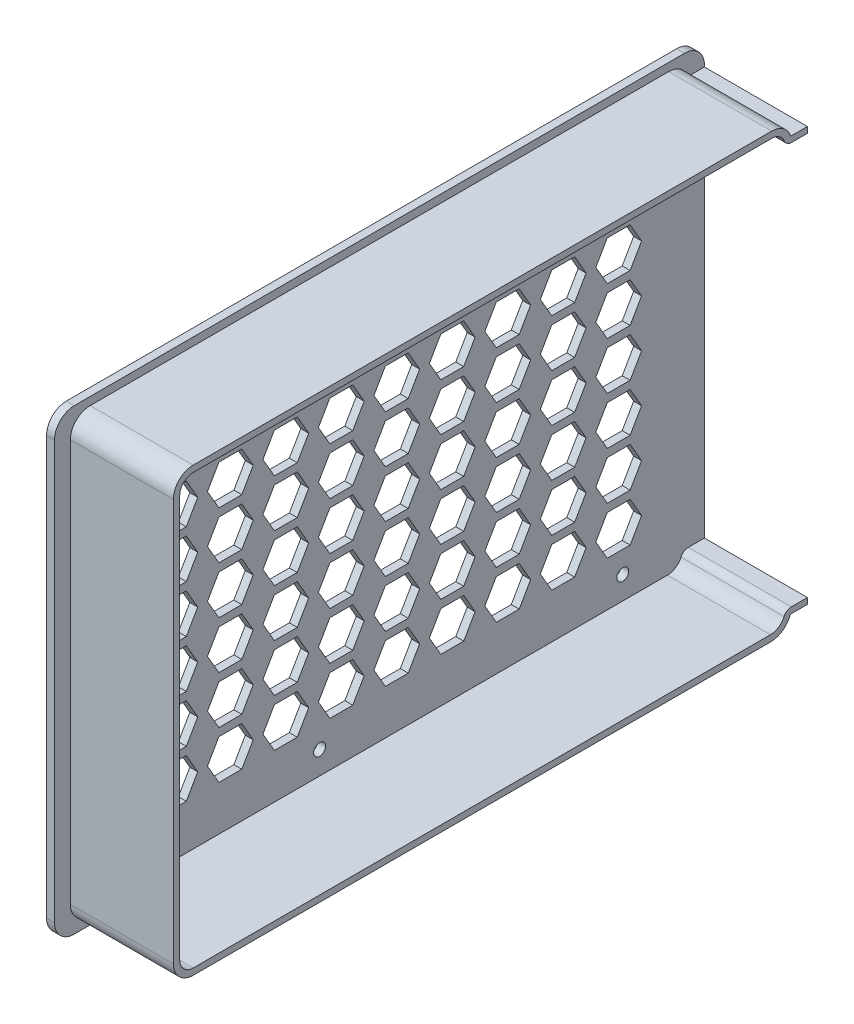
from build123d import *

# Parameters (mm, degrees)
BOSS_EXTRUDE1_DEPTH  = 2
EXTRUDE_THIN1_DEPTH  = 26
BOSS_EXTRUDE2_DEPTH  = 2
CUT_EXTRUDE3_DEPTH   = 117.841789803
LPATTERN1_COUNT      = 10
LPATTERN1_PITCH      = 14
LPATTERN1_COUNT_DIR2 = 7
LPATTERN1_PITCH_DIR2 = 12
SKETCH6_R            = 1.5
CUT_EXTRUDE4_DEPTH   = 117.841789803
SKETCH7_W            = 1.6
SKETCH7_H            = 101.5
CUT_EXTRUDE5_DEPTH   = 26
SKETCH8_W            = 5.6
SKETCH8_H            = 1.5
BOSS_EXTRUDE3_DEPTH  = 26
FILLET1_R            = 2


with BuildPart() as part:
    # Sketch1 → Boss-Extrude1 (new body)
    with BuildSketch(Plane(origin=(0, 0, 0), x_dir=(0, 0, -1), z_dir=(1, 0, 0))):
        with BuildLine():
            Line((-78.16943128, 40.168600894), (67.83056872, 40.168600894))
            ThreePointArc((67.83056872, 40.168600894), (71.366102626, 38.7041348), (72.83056872, 35.168600894))
            Line((72.83056872, 35.168600894), (72.83056872, -66.331399106))
            ThreePointArc((72.83056872, -66.331399106), (71.366102626, -69.866933011), (67.83056872, -71.331399106))
            Line((67.83056872, -71.331399106), (-78.16943128, -71.331399106))
            ThreePointArc((-78.16943128, -71.331399106), (-81.704965186, -69.866933011), (-83.16943128, -66.331399106))
            Line((-83.16943128, -66.331399106), (-83.16943128, 35.168600894))
            ThreePointArc((-83.16943128, 35.168600894), (-81.704965186, 38.7041348), (-78.16943128, 40.168600894))
        make_face()
    extrude(amount=BOSS_EXTRUDE1_DEPTH)



with BuildPart() as body_2:
    # Sketch2 → Extrude-Thin1 (new body)
    with BuildSketch(Plane(origin=(2, 0, 0), x_dir=(0, 0, -1), z_dir=(1, 0, 0))):
        with BuildLine():
            Line((72.83056872, 35.168600894), (72.83056872, -66.331399106))
            ThreePointArc((72.83056872, -66.331399106), (71.154431944, -69.885764747), (67.500243811, -71.331399106))
            Line((67.500243811, -71.331399106), (-78.16943128, -71.331399106))
            ThreePointArc((-78.16943128, -71.331399106), (-81.704965186, -69.866933011), (-83.16943128, -66.331399106))
            Line((-83.16943128, -66.331399106), (-83.16943128, 35.168600894))
            ThreePointArc((-83.16943128, 35.168600894), (-81.704965186, 38.7041348), (-78.16943128, 40.168600894))
            Line((-78.16943128, 40.168600894), (67.83056872, 40.168600894))
            ThreePointArc((67.83056872, 40.168600894), (71.366102626, 38.7041348), (72.83056872, 35.168600894))
        make_face()
        with BuildLine():
            Line((71.23056872, 35.168600894), (71.23056872, -66.275689625))
            ThreePointArc((71.23056872, -66.275689625), (70.042745135, -68.734709434), (67.500243811, -69.731399106))
            Line((67.500243811, -69.731399106), (-78.16943128, -69.731399106))
            ThreePointArc((-78.16943128, -69.731399106), (-80.573594336, -68.735562162), (-81.56943128, -66.331399106))
            Line((-81.56943128, -66.331399106), (-81.56943128, 35.168600894))
            ThreePointArc((-81.56943128, 35.168600894), (-80.573594336, 37.57276395), (-78.16943128, 38.568600894))
            Line((-78.16943128, 38.568600894), (67.83056872, 38.568600894))
            ThreePointArc((67.83056872, 38.568600894), (70.234731776, 37.57276395), (71.23056872, 35.168600894))
        make_face(mode=Mode.SUBTRACT)
    extrude(amount=EXTRUDE_THIN1_DEPTH)


with BuildPart() as part_1:
    add(part.part)

    add(body_2.part)  # Boss-Extrude2 merges body 2
    # Sketch3 → Boss-Extrude2 (add)
    with BuildSketch(Plane.ZY):
        with BuildLine():
            Line((-71.83056872, 42.168600894), (82.16943128, 42.168600894))
            ThreePointArc((82.16943128, 42.168600894), (85.704965186, 40.7041348), (87.16943128, 37.168600894))
            Line((87.16943128, 37.168600894), (87.16943128, -68.331399106))
            ThreePointArc((87.16943128, -68.331399106), (85.704965186, -71.866933011), (82.16943128, -73.331399106))
            Line((82.16943128, -73.331399106), (-71.83056872, -73.331399106))
            ThreePointArc((-71.83056872, -73.331399106), (-75.366102626, -71.866933011), (-76.83056872, -68.331399106))
            Line((-76.83056872, -68.331399106), (-76.83056872, 37.168600894))
            ThreePointArc((-76.83056872, 37.168600894), (-75.366102626, 40.7041348), (-71.83056872, 42.168600894))
        make_face()
    extrude(amount=-BOSS_EXTRUDE2_DEPTH)

    # Sketch5 → Cut-Extrude3 (cut, through all)
    with BuildSketch(Plane(origin=(2, 0, 0), x_dir=(0, 0, -1), z_dir=(1, 0, 0))):
        Polygon((-67.909177242, 13.568600894), (-65.022425896, 18.568600894), (-67.909177242, 23.568600894), (-73.682679934, 23.568600894), (-76.56943128, 18.568600894), (-73.682679934, 13.568600894), align=None)
    cut_extrude3 = extrude(amount=-CUT_EXTRUDE3_DEPTH, mode=Mode.SUBTRACT)

    # LPattern1: Cut-Extrude3 10 × 7
    with Locations(*[(0, -j * LPATTERN1_PITCH_DIR2, -i * LPATTERN1_PITCH) for i in range(LPATTERN1_COUNT) for j in range(LPATTERN1_COUNT_DIR2) if (i, j) != (0, 0)]):
        add(cut_extrude3, mode=Mode.SUBTRACT)

    # Sketch6 → Cut-Extrude4 (cut, through all)
    with BuildSketch(Plane(origin=(2, 0, 0), x_dir=(0, 0, -1), z_dir=(1, 0, 0))):
        with Locations((-20.26943128, 31.568600894)):
            Circle(SKETCH6_R)
        with Locations((56.23056872, 31.568600894)):
            Circle(SKETCH6_R)
        with Locations((-20.26943128, -63.931399106)):
            Circle(SKETCH6_R)
        with Locations((56.23056872, -63.931399106)):
            Circle(SKETCH6_R)
    extrude(amount=-CUT_EXTRUDE4_DEPTH, mode=Mode.SUBTRACT)

    # Sketch7 → Cut-Extrude5 (cut)
    with BuildSketch(Plane(origin=(28, 0, 0), x_dir=(0, 0, -1), z_dir=(1, 0, 0))):
        with Locations((72.03056872, -15.581399106)):
            Rectangle(SKETCH7_W, SKETCH7_H)
    extrude(amount=-CUT_EXTRUDE5_DEPTH, mode=Mode.SUBTRACT)

    # Sketch8 → Boss-Extrude3 (add)
    with BuildSketch(Plane(origin=(2, 0, 0), x_dir=(0, 0, -1), z_dir=(1, 0, 0))):
        with Locations((74.03056872, -67.025689625)):
            Rectangle(SKETCH8_W, SKETCH8_H)
        with Locations((74.03056872, 35.918600894)):
            Rectangle(SKETCH8_W, SKETCH8_H)
    extrude(amount=BOSS_EXTRUDE3_DEPTH)

    # Fillet1
    fillet1_edges = [part_1.edges().sort_by_distance(p)[0] for p in [
        (15, -66.275689625, -71.23056872),
        (15, 35.168600894, -71.23056872),
    ]]
    fillet(fillet1_edges, radius=FILLET1_R)


solid = part_1.part
